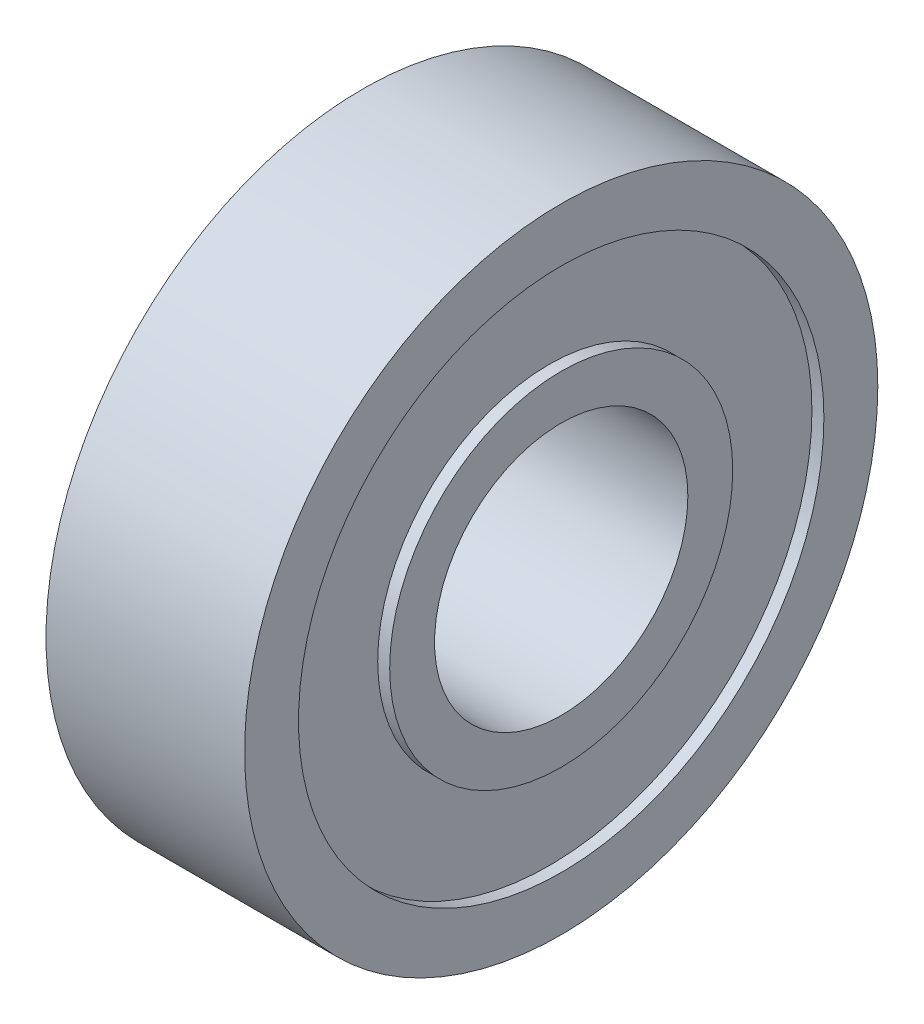
from build123d import *


with BuildPart() as part:
    # Sketch1 → Revolve1 (revolve)
    with BuildSketch(Plane.XY, mode=Mode.PRIVATE) as revolve1_sk:
        Polygon((2.4892, 3.175), (-2.4892, 3.175), (-2.4892, 4.3), (-2.1892, 4.3), (-2.1892, 6.586), (-2.4892, 6.586), (-2.4892, 7.9375), (2.4892, 7.9375), (2.4892, 6.586), (2.1892, 6.586), (2.1892, 4.3), (2.4892, 4.3), align=None)
    revolve(revolve1_sk.sketch.rotate(Axis((0, 0, 0), (-1, 0, 0)), 90), axis=Axis((0, 0, 0), (-1, 0, 0)))


solid = part.part
